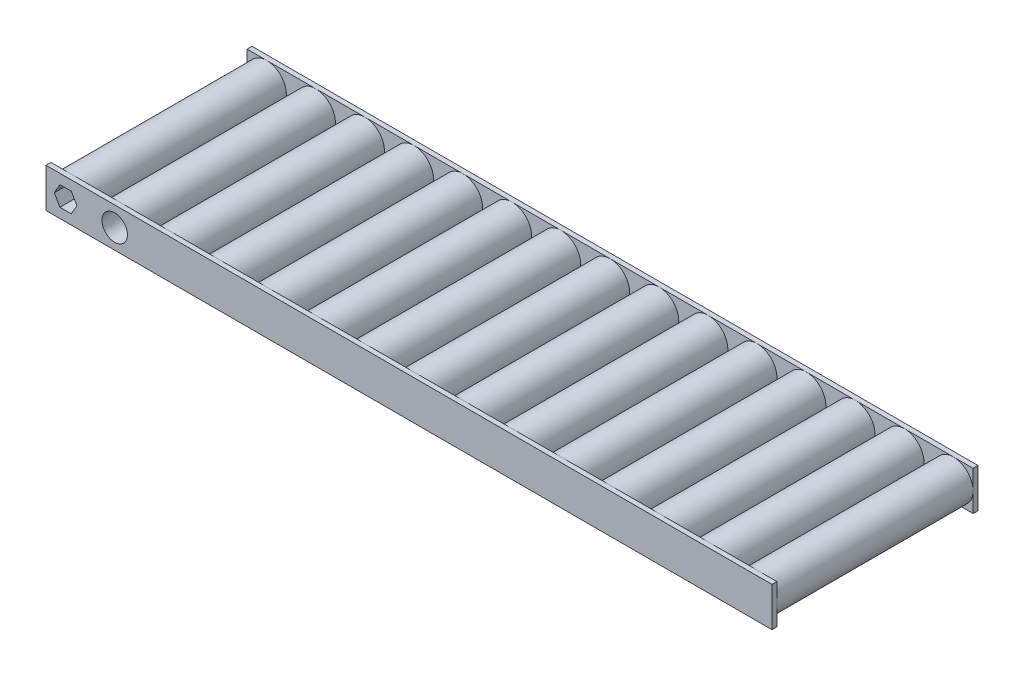
from build123d import *

# Parameters (mm, degrees)
SKETCH1_R           = 12.7
BOSS_EXTRUDE1_DEPTH = 127
LPATTERN1_COUNT     = 15
LPATTERN1_PITCH     = 31.75
SKETCH2_W           = 469.9
SKETCH2_H           = 25.4
BOSS_EXTRUDE2_DEPTH = 3.175
SKETCH3_R           = 8.255
CUT_EXTRUDE1_DEPTH  = 477.41930324


with BuildPart() as part:
    # Sketch1 → Boss-Extrude1 (new body)
    with BuildSketch(Plane.XY):
        Circle(SKETCH1_R)
    extrude(amount=BOSS_EXTRUDE1_DEPTH)


with BuildPart() as lpattern1_1:
    # LPattern1: pattern copy
    add(part.part.moved(Location(Vector(1, 0, 0) * (1 * LPATTERN1_PITCH))))


with BuildPart() as lpattern1_2:
    # LPattern1: pattern copy
    add(part.part.moved(Location(Vector(1, 0, 0) * (2 * LPATTERN1_PITCH))))


with BuildPart() as lpattern1_3:
    # LPattern1: pattern copy
    add(part.part.moved(Location(Vector(1, 0, 0) * (3 * LPATTERN1_PITCH))))


with BuildPart() as lpattern1_4:
    # LPattern1: pattern copy
    add(part.part.moved(Location(Vector(1, 0, 0) * (4 * LPATTERN1_PITCH))))


with BuildPart() as lpattern1_5:
    # LPattern1: pattern copy
    add(part.part.moved(Location(Vector(1, 0, 0) * (5 * LPATTERN1_PITCH))))


with BuildPart() as lpattern1_6:
    # LPattern1: pattern copy
    add(part.part.moved(Location(Vector(1, 0, 0) * (6 * LPATTERN1_PITCH))))


with BuildPart() as lpattern1_7:
    # LPattern1: pattern copy
    add(part.part.moved(Location(Vector(1, 0, 0) * (7 * LPATTERN1_PITCH))))


with BuildPart() as lpattern1_8:
    # LPattern1: pattern copy
    add(part.part.moved(Location(Vector(1, 0, 0) * (8 * LPATTERN1_PITCH))))


with BuildPart() as lpattern1_9:
    # LPattern1: pattern copy
    add(part.part.moved(Location(Vector(1, 0, 0) * (9 * LPATTERN1_PITCH))))


with BuildPart() as lpattern1_10:
    # LPattern1: pattern copy
    add(part.part.moved(Location(Vector(1, 0, 0) * (10 * LPATTERN1_PITCH))))


with BuildPart() as lpattern1_11:
    # LPattern1: pattern copy
    add(part.part.moved(Location(Vector(1, 0, 0) * (11 * LPATTERN1_PITCH))))


with BuildPart() as lpattern1_12:
    # LPattern1: pattern copy
    add(part.part.moved(Location(Vector(1, 0, 0) * (12 * LPATTERN1_PITCH))))


with BuildPart() as lpattern1_13:
    # LPattern1: pattern copy
    add(part.part.moved(Location(Vector(1, 0, 0) * (13 * LPATTERN1_PITCH))))


with BuildPart() as lpattern1_14:
    # LPattern1: pattern copy
    add(part.part.moved(Location(Vector(1, 0, 0) * (14 * LPATTERN1_PITCH))))


with BuildPart() as part_1:
    add(part.part)

    add(lpattern1_1.part)  # Boss-Extrude2 merges LPattern1_1

    add(lpattern1_2.part)  # Boss-Extrude2 merges LPattern1_2

    add(lpattern1_3.part)  # Boss-Extrude2 merges LPattern1_3

    add(lpattern1_4.part)  # Boss-Extrude2 merges LPattern1_4

    add(lpattern1_5.part)  # Boss-Extrude2 merges LPattern1_5

    add(lpattern1_6.part)  # Boss-Extrude2 merges LPattern1_6

    add(lpattern1_7.part)  # Boss-Extrude2 merges LPattern1_7

    add(lpattern1_8.part)  # Boss-Extrude2 merges LPattern1_8

    add(lpattern1_9.part)  # Boss-Extrude2 merges LPattern1_9

    add(lpattern1_10.part)  # Boss-Extrude2 merges LPattern1_10

    add(lpattern1_11.part)  # Boss-Extrude2 merges LPattern1_11

    add(lpattern1_12.part)  # Boss-Extrude2 merges LPattern1_12

    add(lpattern1_13.part)  # Boss-Extrude2 merges LPattern1_13

    add(lpattern1_14.part)  # Boss-Extrude2 merges LPattern1_14
    # Sketch2 → Boss-Extrude2 (add)
    with BuildSketch(Plane.XY.offset(127)):
        with Locations((222.25, 0)):
            Rectangle(SKETCH2_W, SKETCH2_H)
    boss_extrude2 = extrude(amount=BOSS_EXTRUDE2_DEPTH)

    # Mirror1: Boss-Extrude2 across plane
    add(boss_extrude2.mirror(Plane.XY.offset(63.5)))

    # Sketch3 → Cut-Extrude1 (cut, through all)
    with BuildSketch(Plane.XY.offset(130.175)):
        with Locations((31.75, 0)):
            Circle(SKETCH3_R)
        Polygon((7.332348419, 0), (3.666174209, 6.35), (-3.666174209, 6.35), (-7.332348419, 0), (-3.666174209, -6.35), (3.666174209, -6.35), align=None)
    extrude(amount=-CUT_EXTRUDE1_DEPTH, mode=Mode.SUBTRACT)


solid = part_1.part
